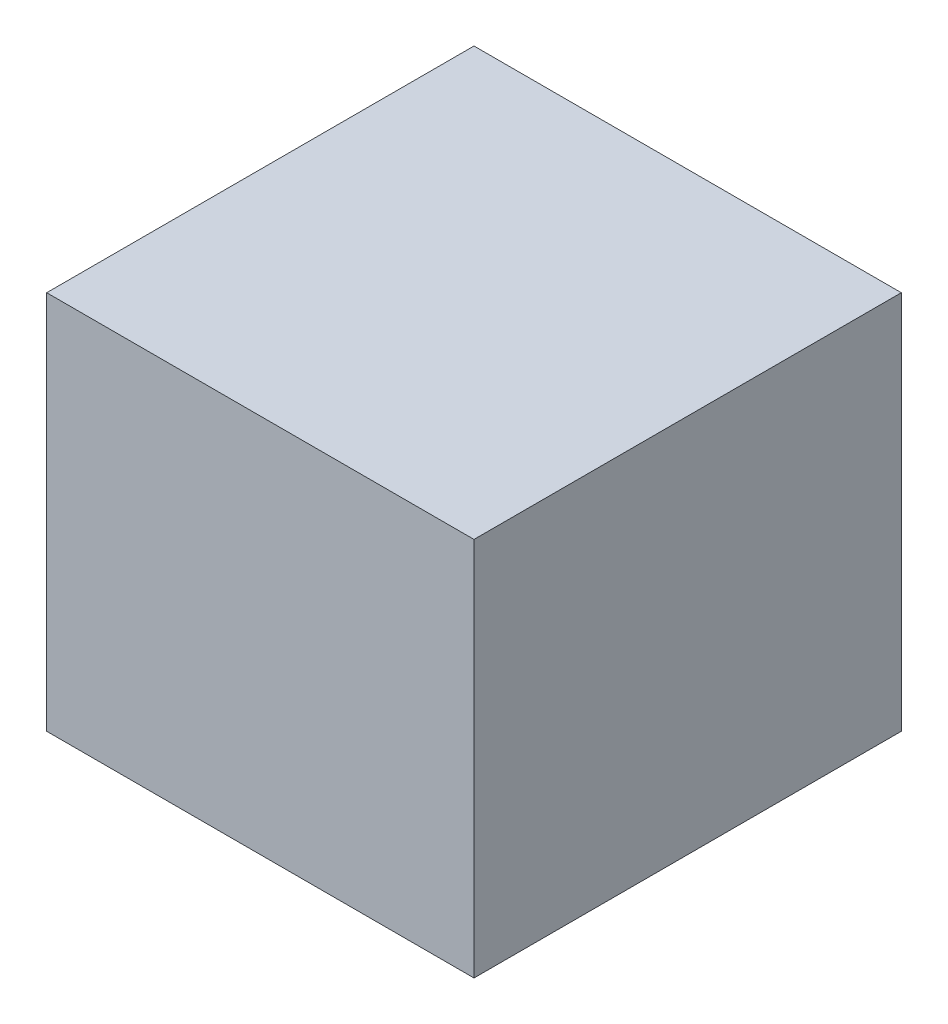
from build123d import *

# Parameters (mm, degrees)
SKICA1_W                = 180
SKICA1_H                = 180
P_IDAT_VYSUNUT_M1_DEPTH = 160


with BuildPart() as part:
    # Skica1 → Přidat vysunutím1 (new body)
    with BuildSketch(Plane(origin=(0, 0, 0), x_dir=(1, 0, 0), z_dir=(0, 1, 0))):
        with Locations((90, 90)):
            Rectangle(SKICA1_W, SKICA1_H)
    extrude(amount=P_IDAT_VYSUNUT_M1_DEPTH)


solid = part.part
